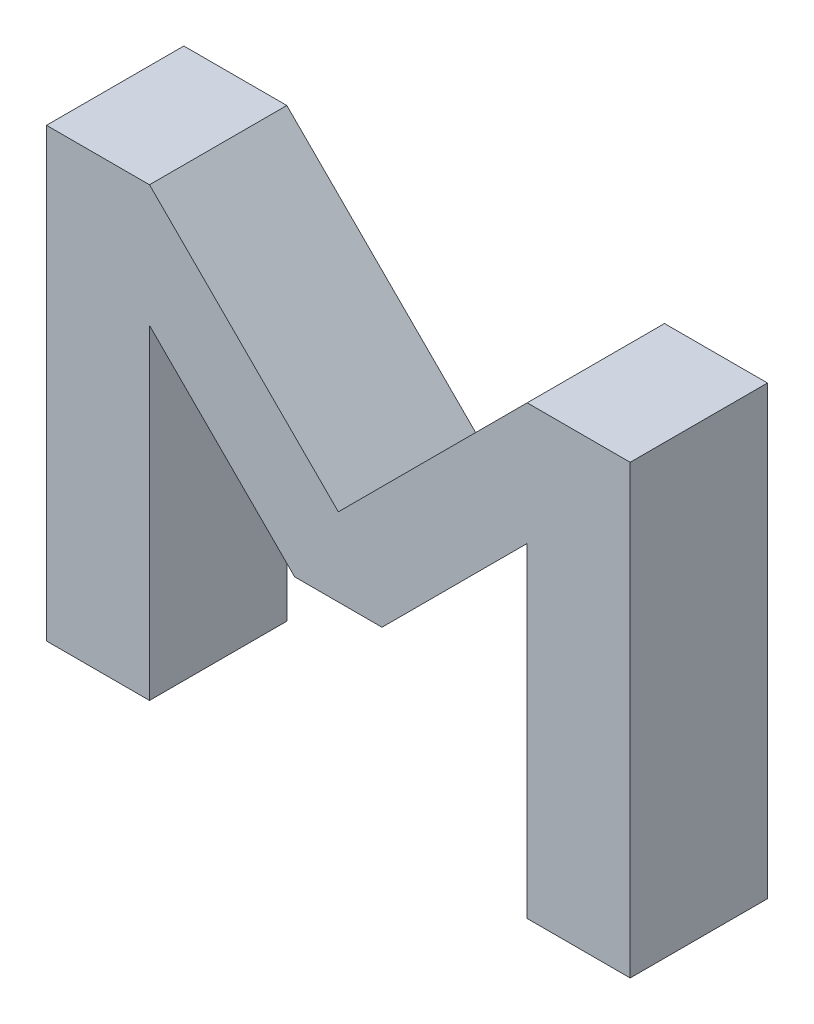
from build123d import *

# Parameters (mm, degrees)
BOSS_EXTRUDE1_DEPTH = 20


with BuildPart() as part:
    # Sketch1 → Boss-Extrude1 (new body)
    with BuildSketch(Plane.XY):
        Polygon((175.078092116, 68.182135251), (175.078092116, 133.228481614), (190.078092116, 133.228481614), (217.57996616, 105.72660757), (245.081840203, 133.228481614), (260.081840203, 133.228481614), (260.081840203, 68.182135251), (245.081840203, 68.182135251), (245.081840203, 115.488568969), (223.939272913, 94.346001679), (211.220659406, 94.346001679), (190.078092116, 115.488568969), (190.078092116, 68.182135251), align=None)
    extrude(amount=BOSS_EXTRUDE1_DEPTH)


solid = part.part
